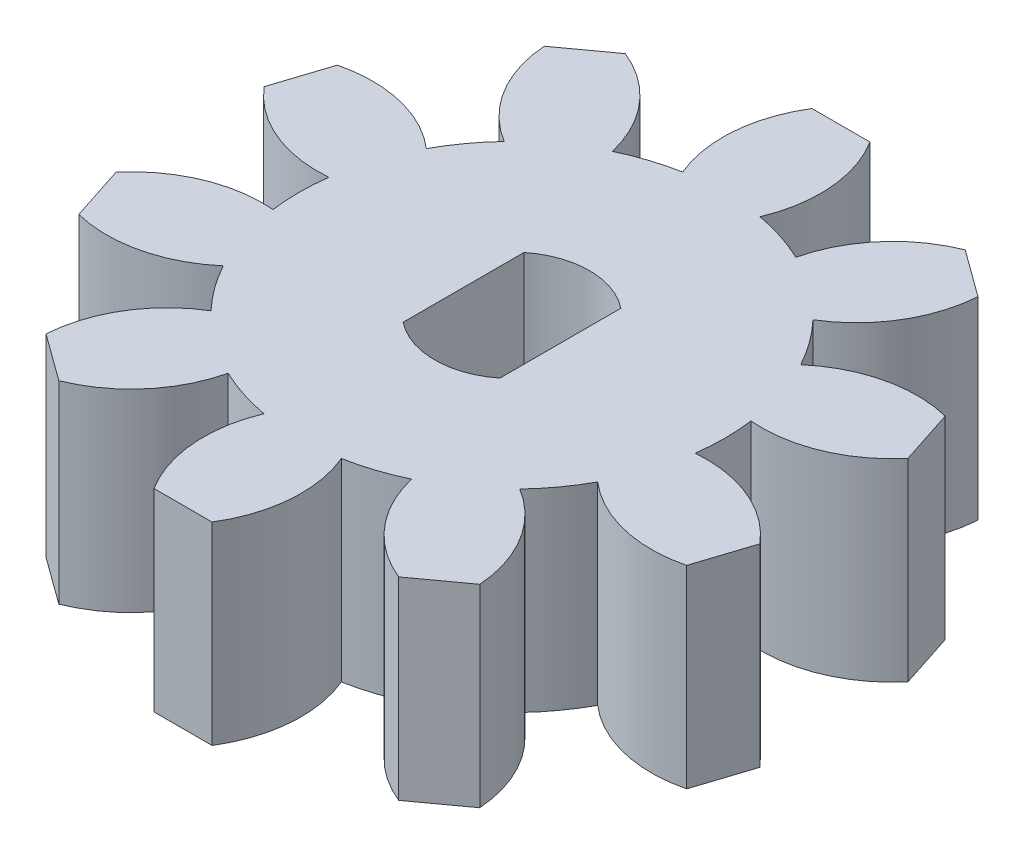
from build123d import *

# Parameters (mm, degrees)
SKETCH_1_R          = 5.5
EXTRUDE_1_DEPTH     = 5
EXTRUDE_START       = -5
EXTRUDE_2_DEPTH     = 5
CUT_EXTRUDE_1_REACH = 14.9


with BuildPart() as part:
    # 草图1 → 凸台-拉伸1 (new body)
    with BuildSketch(Plane(origin=(0, 0, 0), x_dir=(1, 0, 0), z_dir=(0, 1, 0))):
        with Locations(Location((0, 0, 0), (0, 0, 270))):
            Circle(SKETCH_1_R)
    extrude(amount=EXTRUDE_1_DEPTH)

    # 草图2 → 凸台-拉伸2 (add)
    with BuildSketch(Plane(origin=(0, 5, 0), x_dir=(-1, 0, 0), z_dir=(0, 1, 0)).offset(EXTRUDE_START)):
        with BuildLine():
            Line((-4.389411899, -7.317483391), (-5.60293739, -6.435805513))
            ThreePointArc((-5.60293739, -6.435805513), (-5.11774735, -4.915167527), (-3.987951794, -3.787643132))
            ThreePointArc((-3.987951794, -3.787643132), (-3.232818888, -4.449593469), (-2.369917805, -4.963213636))
            ThreePointArc((-2.369917805, -4.963213636), (-3.093131201, -6.386137262), (-4.389411899, -7.317483391))
        make_face()
        with BuildLine():
            Line((-7.852217643, -3.339936839), (-8.315743134, -1.913352065))
            ThreePointArc((-8.315743134, -1.913352065), (-7.029407564, -0.968317642), (-5.452641547, -0.720208411))
            ThreePointArc((-5.452641547, -0.720208411), (-5.23081084, -1.699593469), (-4.834607559, -2.622321444))
            ThreePointArc((-4.834607559, -2.622321444), (-6.256073009, -3.34839667), (-7.852217643, -3.339936839))
        make_face()
        with BuildLine():
            Line((-8.315743134, 1.913352065), (-7.852217643, 3.339936839))
            ThreePointArc((-7.852217643, 3.339936839), (-6.256073009, 3.34839667), (-4.834607559, 2.622321444))
            ThreePointArc((-4.834607559, 2.622321444), (-5.23081084, 1.699593469), (-5.452641547, 0.720208411))
            ThreePointArc((-5.452641547, 0.720208411), (-7.029407564, 0.968317642), (-8.315743134, 1.913352065))
        make_face()
        with BuildLine():
            Line((-5.60293739, 6.435805513), (-4.389411899, 7.317483391))
            ThreePointArc((-4.389411899, 7.317483391), (-3.093131201, 6.386137262), (-2.369917805, 4.963213636))
            ThreePointArc((-2.369917805, 4.963213636), (-3.232818888, 4.449593469), (-3.987951794, 3.787643132))
            ThreePointArc((-3.987951794, 3.787643132), (-5.11774735, 4.915167527), (-5.60293739, 6.435805513))
        make_face()
        with BuildLine():
            Line((-0.75, 8.5), (0.75, 8.5))
            ThreePointArc((0.75, 8.5), (1.251281594, 6.984590476), (1, 5.408326913))
            ThreePointArc((1, 5.408326913), (0, 5.5), (-1, 5.408326913))
            ThreePointArc((-1, 5.408326913), (-1.251281594, 6.984590476), (-0.75, 8.5))
        make_face()
        with BuildLine():
            Line((4.389411899, 7.317483391), (5.60293739, 6.435805513))
            ThreePointArc((5.60293739, 6.435805513), (5.11774735, 4.915167527), (3.987951794, 3.787643132))
            ThreePointArc((3.987951794, 3.787643132), (3.232818888, 4.449593469), (2.369917805, 4.963213636))
            ThreePointArc((2.369917805, 4.963213636), (3.093131201, 6.386137262), (4.389411899, 7.317483391))
        make_face()
        with BuildLine():
            Line((0.75, -8.5), (-0.75, -8.5))
            ThreePointArc((-0.75, -8.5), (-1.251281594, -6.984590476), (-1, -5.408326913))
            ThreePointArc((-1, -5.408326913), (0, -5.5), (1, -5.408326913))
            ThreePointArc((1, -5.408326913), (1.251281594, -6.984590476), (0.75, -8.5))
        make_face()
        with BuildLine():
            Line((7.852217643, 3.339936839), (8.315743134, 1.913352065))
            ThreePointArc((8.315743134, 1.913352065), (7.029407564, 0.968317642), (5.452641547, 0.720208411))
            ThreePointArc((5.452641547, 0.720208411), (5.23081084, 1.699593469), (4.834607559, 2.622321444))
            ThreePointArc((4.834607559, 2.622321444), (6.256073009, 3.34839667), (7.852217643, 3.339936839))
        make_face()
        with BuildLine():
            Line((8.315743134, -1.913352065), (7.852217643, -3.339936839))
            ThreePointArc((7.852217643, -3.339936839), (6.256073009, -3.34839667), (4.834607559, -2.622321444))
            ThreePointArc((4.834607559, -2.622321444), (5.23081084, -1.699593469), (5.452641547, -0.720208411))
            ThreePointArc((5.452641547, -0.720208411), (7.029407564, -0.968317642), (8.315743134, -1.913352065))
        make_face()
        with BuildLine():
            Line((5.60293739, -6.435805513), (4.389411899, -7.317483391))
            ThreePointArc((4.389411899, -7.317483391), (3.093131201, -6.386137262), (2.369917805, -4.963213636))
            ThreePointArc((2.369917805, -4.963213636), (3.232818888, -4.449593469), (3.987951794, -3.787643132))
            ThreePointArc((3.987951794, -3.787643132), (5.11774735, -4.915167527), (5.60293739, -6.435805513))
        make_face()
    extrude(amount=EXTRUDE_2_DEPTH)

    # 草图3 → 切除-拉伸1 (cut, up to next)
    with BuildSketch(Plane(origin=(0, 5, 0), x_dir=(-1, 0, 0), z_dir=(0, 1, 0)), mode=Mode.PRIVATE) as cut_extrude_1_sk1:
        with BuildLine():
            Line((1.25, -1.5612495), (1.25, 1.5612495))
            ThreePointArc((1.25, 1.5612495), (0, 2), (-1.25, 1.5612495))
            Line((-1.25, 1.5612495), (-1.25, -1.5612495))
            ThreePointArc((-1.25, -1.5612495), (0, -2), (1.25, -1.5612495))
        make_face()
    cut_extrude_1_tool1 = extrude(cut_extrude_1_sk1.sketch, amount=-CUT_EXTRUDE_1_REACH, mode=Mode.PRIVATE) & part.part
    add(cut_extrude_1_tool1.solids().sort_by_distance((0, 5, 0))[0], mode=Mode.SUBTRACT)


solid = part.part
